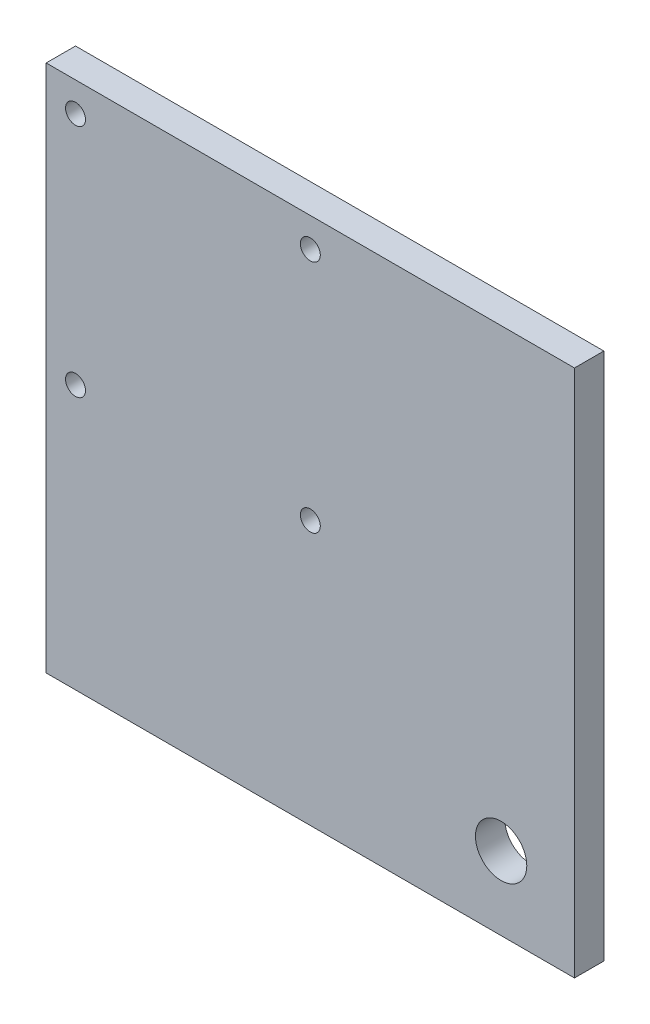
from build123d import *

# Parameters (mm, degrees)
SKETCH_1_W      = 180
SKETCH_1_H      = 180
SKETCH_1_R      = 3.4
SKETCH_1_R_2    = 8.75
EXTRUDE_1_DEPTH = 10


with BuildPart() as part:
    # 草图1 → 凸台-拉伸1 (new body)
    with BuildSketch(Plane(origin=(0, 0, 0), x_dir=(-1, 0, 0), z_dir=(0, 0, 1))):
        with Locations((65, 160)):
            Rectangle(SKETCH_1_W, SKETCH_1_H)
        with Locations(Location((145, 160, 0), (0, 0, 180))):
            Circle(SKETCH_1_R, mode=Mode.SUBTRACT)
        with Locations(Location((65, 160, 0), (0, 0, 180))):
            Circle(SKETCH_1_R, mode=Mode.SUBTRACT)
        with Locations(Location((0, 225, 0), (0, 0, 180))):
            Circle(SKETCH_1_R_2, mode=Mode.SUBTRACT)
        with Locations(Location((145, 80, 0), (0, 0, 180))):
            Circle(SKETCH_1_R, mode=Mode.SUBTRACT)
        with Locations(Location((65, 80, 0), (0, 0, 180))):
            Circle(SKETCH_1_R, mode=Mode.SUBTRACT)
    extrude(amount=EXTRUDE_1_DEPTH)


solid = part.part
